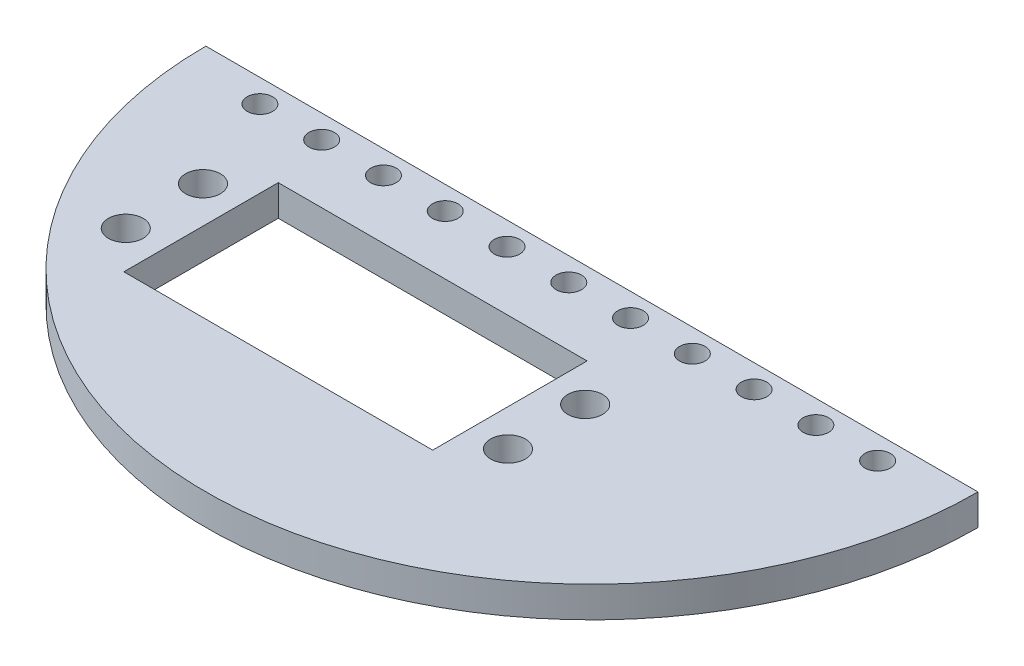
from build123d import *

# Parameters (mm, degrees)
EXTRUDE_1_DEPTH     = 4
CUT_EXTRUDE_1_DEPTH = 10
SKETCH_3_R          = 2.25
CUT_EXTRUDE_2_DEPTH = 10
SKETCH_4_R          = 1.65
CUT_EXTRUDE_3_DEPTH = 10


with BuildPart() as part:
    # 草图1 → 凸台-拉伸1 (new body)
    with BuildSketch(Plane(origin=(0, 0, 0), x_dir=(1, 0, 0), z_dir=(0, 1, 0))):
        with BuildLine():
            Line((-50, 0), (50, 0))
            ThreePointArc((50, 0), (0, -50), (-50, 0))
        make_face()
    extrude(amount=EXTRUDE_1_DEPTH)

    # 草图2 → 切除-拉伸1 (cut)
    with BuildSketch(Plane(origin=(0, 4, 0), x_dir=(1, 0, 0), z_dir=(0, 1, 0))):
        Polygon((0, -10.623043888), (10, -10.623043888), (10, -30.623043888), (-30, -30.623043888), (-30, -10.623043888), align=None)
    extrude(amount=-CUT_EXTRUDE_1_DEPTH, mode=Mode.SUBTRACT)

    # 草图3 → 切除-拉伸2 (cut)
    with BuildSketch(Plane(origin=(0, 4, 0), x_dir=(1, 0, 0), z_dir=(0, 1, 0))):
        with Locations(Location((-34.75, -15.623043888, 0), (0, 0, 270))):
            Circle(SKETCH_3_R)
        with Locations(Location((-34.75, -25.623043888, 0), (0, 0, 270))):
            Circle(SKETCH_3_R)
        with Locations(Location((14.75, -25.623043888, 0), (0, 0, 90))):
            Circle(SKETCH_3_R)
        with Locations(Location((14.75, -15.623043888, 0), (0, 0, 90))):
            Circle(SKETCH_3_R)
    extrude(amount=-CUT_EXTRUDE_2_DEPTH, mode=Mode.SUBTRACT)

    # 草图4 → 切除-拉伸3 (cut)
    with BuildSketch(Plane(origin=(0, 4, 0), x_dir=(1, 0, 0), z_dir=(0, 1, 0))):
        with Locations(Location((0, -3, 0), (0, 0, 270))):
            Circle(SKETCH_4_R)
        with Locations(Location((8, -3, 0), (0, 0, 270))):
            Circle(SKETCH_4_R)
        with Locations(Location((16, -3, 0), (0, 0, 270))):
            Circle(SKETCH_4_R)
        with Locations(Location((24, -3, 0), (0, 0, 270))):
            Circle(SKETCH_4_R)
        with Locations(Location((32, -3, 0), (0, 0, 270))):
            Circle(SKETCH_4_R)
        with Locations(Location((40, -3, 0), (0, 0, 270))):
            Circle(SKETCH_4_R)
        with Locations(Location((-40, -3, 0), (0, 0, 90))):
            Circle(SKETCH_4_R)
        with Locations(Location((-32, -3, 0), (0, 0, 90))):
            Circle(SKETCH_4_R)
        with Locations(Location((-24, -3, 0), (0, 0, 90))):
            Circle(SKETCH_4_R)
        with Locations(Location((-16, -3, 0), (0, 0, 90))):
            Circle(SKETCH_4_R)
        with Locations(Location((-8, -3, 0), (0, 0, 90))):
            Circle(SKETCH_4_R)
    extrude(amount=-CUT_EXTRUDE_3_DEPTH, mode=Mode.SUBTRACT)


solid = part.part
